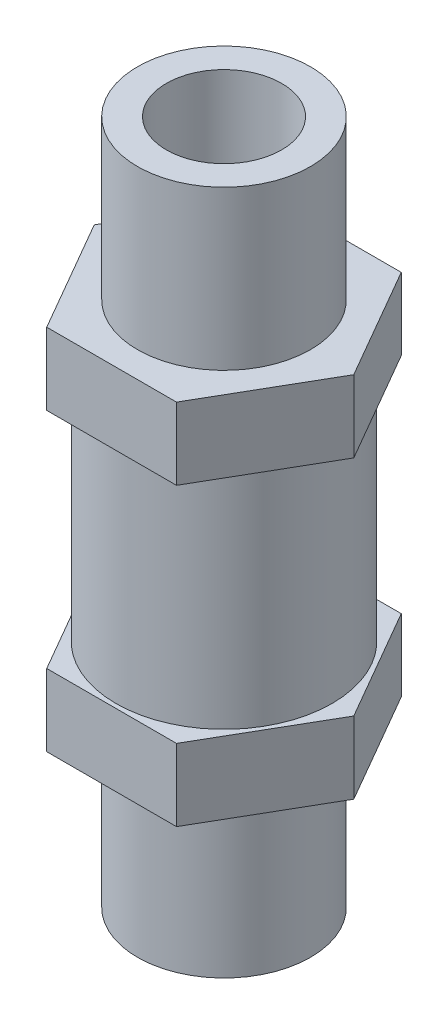
from build123d import *

# Parameters (mm, degrees)
CUT_EXTRUDE_1_DEPTH = 30


with BuildPart() as part:
    # Эскиз2 → Повернуть1 (revolve)
    with BuildSketch(Plane.XY):
        Polygon((4, -4.539806968), (6, -4.539806968), (6, 6.460193032), (9, 6.460193032), (9, 11.460193032), (7.5, 11.460193032), (7.5, 26.960193032), (9, 26.960193032), (9, 31.960193032), (6, 31.960193032), (6, 42.960193032), (4, 42.960193032), (4, 32.960193032), (2.5, 32.960193032), (2.5, 23.960193032), (0, 23.960193032), (0, 15.460193032), (2.5, 15.460193032), (2.5, 5.460193032), (4, 5.460193032), align=None)
    revolve(axis=Axis((0, 15.460193032, 0), (0, 1, 0)))

    # Эскиз3 → Вырез-Вытянуть1 (cut)
    with BuildSketch(Plane(origin=(0, 31.960193032, 0), x_dir=(1, 0, 0), z_dir=(0, 1, 0))):
        with BuildLine():
            Line((-9, 0), (-4.5, 7.794228634))
            ThreePointArc((-4.5, 7.794228634), (-7.794228634, 4.5), (-9, 0))
        make_face()
        with BuildLine():
            Line((-4.5, 7.794228634), (4.5, 7.794228634))
            ThreePointArc((4.5, 7.794228634), (0, 9), (-4.5, 7.794228634))
        make_face()
        with BuildLine():
            Line((4.5, 7.794228634), (9, 0))
            ThreePointArc((9, 0), (7.794228634, 4.5), (4.5, 7.794228634))
        make_face()
        with BuildLine():
            ThreePointArc((4.5, -7.794228634), (7.794228634, -4.5), (9, 0))
            Line((9, 0), (4.5, -7.794228634))
        make_face()
        with BuildLine():
            ThreePointArc((-4.5, -7.794228634), (0, -9), (4.5, -7.794228634))
            Line((4.5, -7.794228634), (-4.5, -7.794228634))
        make_face()
        with BuildLine():
            ThreePointArc((-9, 0), (-7.794228634, -4.5), (-4.5, -7.794228634))
            Line((-4.5, -7.794228634), (-9, 0))
        make_face()
    extrude(amount=-CUT_EXTRUDE_1_DEPTH, mode=Mode.SUBTRACT)


solid = part.part
